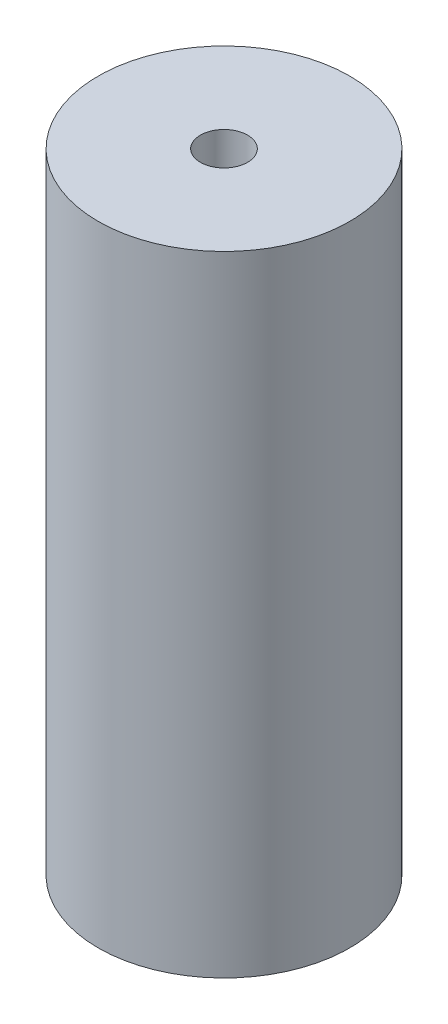
from build123d import *

# Parameters (mm, degrees)
SKETCH1_R           = 8
BOSS_EXTRUDE1_DEPTH = 40
SKETCH2_R           = 1.5
CUT_EXTRUDE1_DEPTH  = 42.569219382


with BuildPart() as part:
    # Sketch1 → Boss-Extrude1 (new body)
    with BuildSketch(Plane(origin=(0, 0, 0), x_dir=(1, 0, 0), z_dir=(0, 1, 0))):
        with Locations(Location((0, 0, 0), (0, 0, 270))):
            Circle(SKETCH1_R)
    extrude(amount=BOSS_EXTRUDE1_DEPTH)

    # Sketch2 → Cut-Extrude1 (cut, through all)
    with BuildSketch(Plane(origin=(0, 40, 0), x_dir=(1, 0, 0), z_dir=(0, 1, 0))):
        with Locations(Location((0, 0, 0), (0, 0, 270))):
            Circle(SKETCH2_R)
    extrude(amount=-CUT_EXTRUDE1_DEPTH, mode=Mode.SUBTRACT)


solid = part.part
